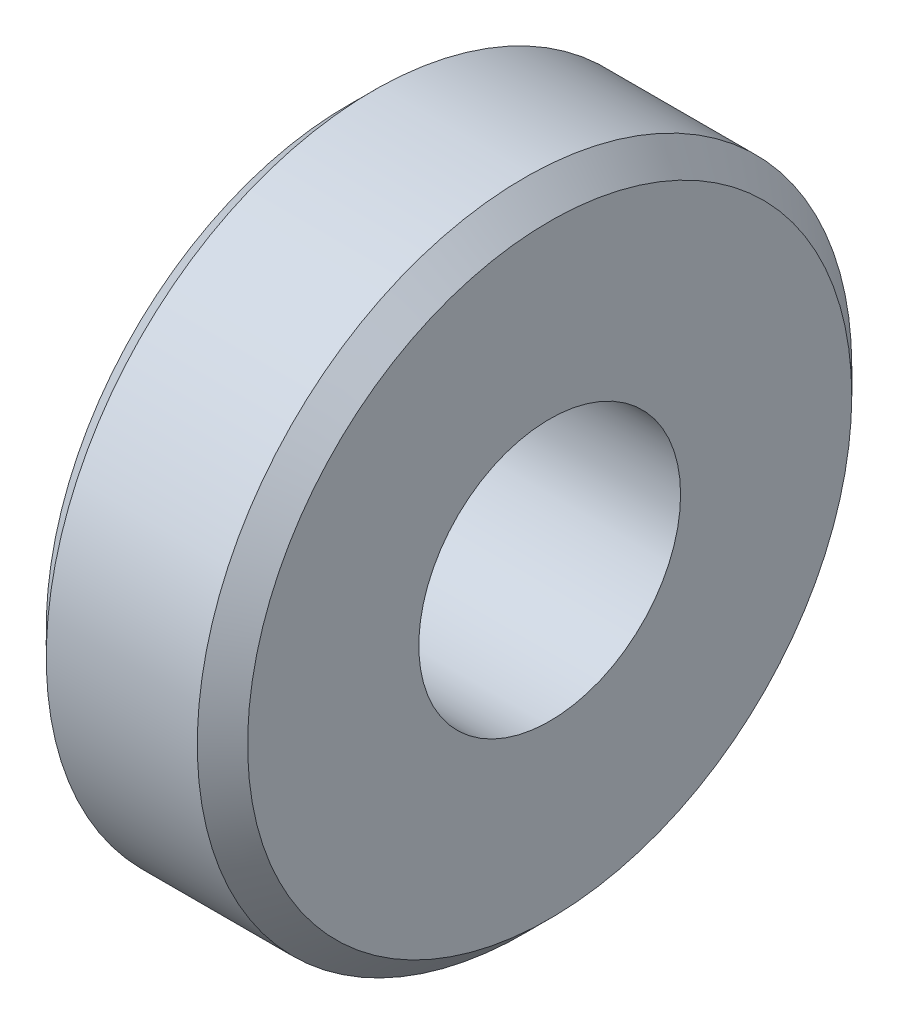
from build123d import *

# Parameters (mm, degrees)
SKETCH_1_R      = 6.5
SKETCH_1_R_2    = 2.6
EXTRUDE_1_DEPTH = 4
CHAMFER_1_SIZE  = 0.5


with BuildPart() as part:
    # 草图1 → 凸台-拉伸1 (new body)
    with BuildSketch(Plane.YZ):
        with Locations(Location((0, 0, 0), (0, 0, 270))):
            Circle(SKETCH_1_R)
        with Locations(Location((0, 0, 0), (0, 0, 270))):
            Circle(SKETCH_1_R_2, mode=Mode.SUBTRACT)
    extrude(amount=EXTRUDE_1_DEPTH)

    # 倒角1
    chamfer_1_edges = [part.edges().sort_by_distance(p)[0] for p in [
        (0, 0, 6.5),
        (4, 0, 6.5),
    ]]
    chamfer(chamfer_1_edges, length=CHAMFER_1_SIZE)


solid = part.part
